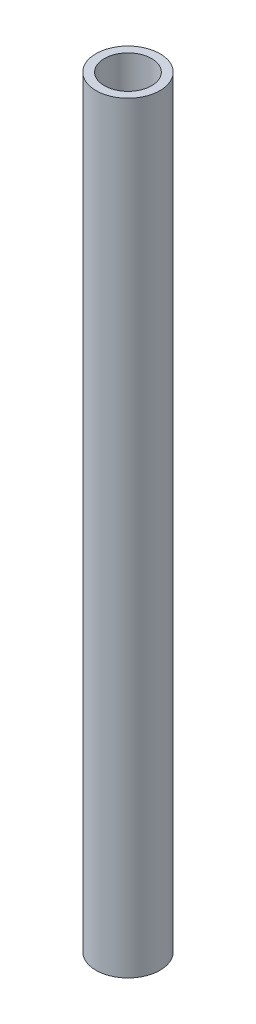
from build123d import *

# Parameters (mm, degrees)
SKETCH1_R           = 10.668
SKETCH1_R_2         = 7.874
BOSS_EXTRUDE1_DEPTH = 127


with BuildPart() as part:
    # Sketch1 → Boss-Extrude1 (new, symmetric)
    with BuildSketch(Plane(origin=(0, 0, 0), x_dir=(1, 0, 0), z_dir=(0, 1, 0))):
        with Locations(Location((0, 0, 0), (0, 0, 270))):
            Circle(SKETCH1_R)
        with Locations(Location((0, 0, 0), (0, 0, 270))):
            Circle(SKETCH1_R_2, mode=Mode.SUBTRACT)
    extrude(amount=BOSS_EXTRUDE1_DEPTH, both=True)


solid = part.part
